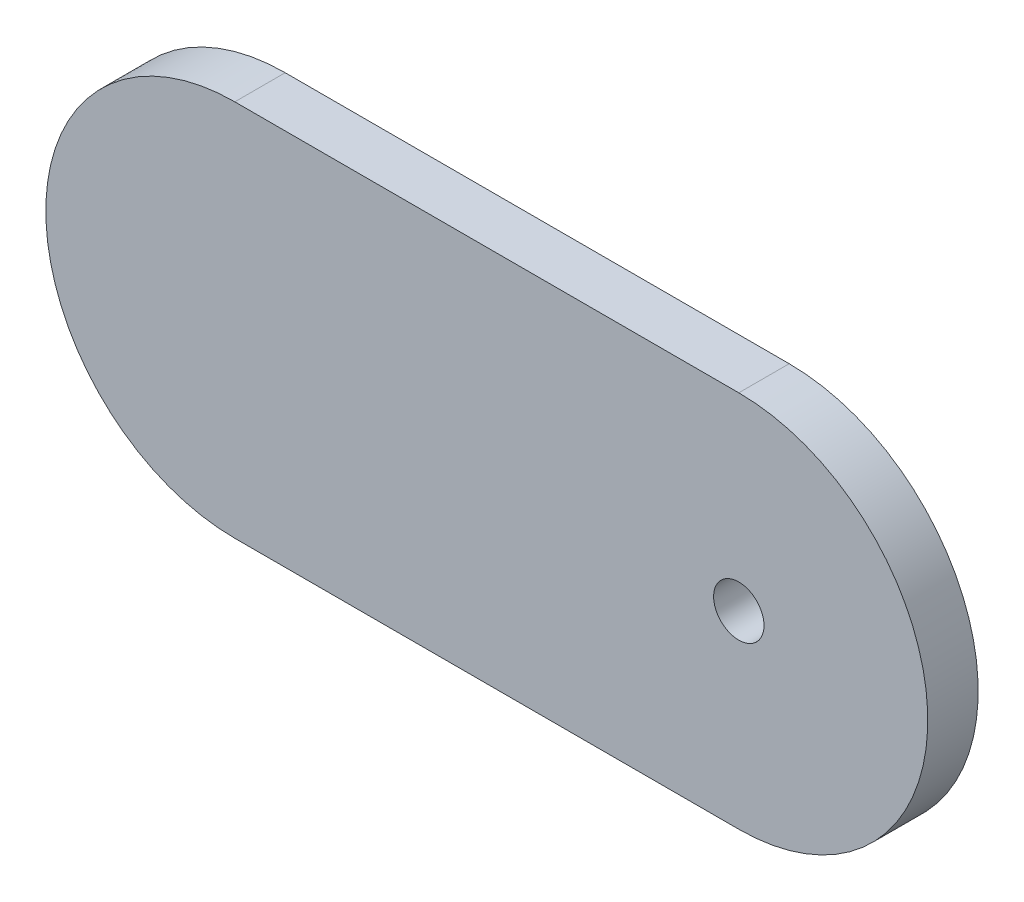
from build123d import *

# Parameters (mm, degrees)
ESQUISSE1_R        = 2
BOSS_EXTRU_1_DEPTH = 4


with BuildPart() as part:
    # Esquisse1 → Boss.-Extru.1 (new body)
    with BuildSketch(Plane.XY):
        with BuildLine():
            Line((0, 15), (40, 15))
            ThreePointArc((40, 15), (55, 0), (40, -15))
            Line((40, -15), (0, -15))
            ThreePointArc((0, -15), (-15, 0), (0, 15))
        make_face()
        with Locations((40, 0)):
            Circle(ESQUISSE1_R, mode=Mode.SUBTRACT)
    extrude(amount=BOSS_EXTRU_1_DEPTH)


solid = part.part
